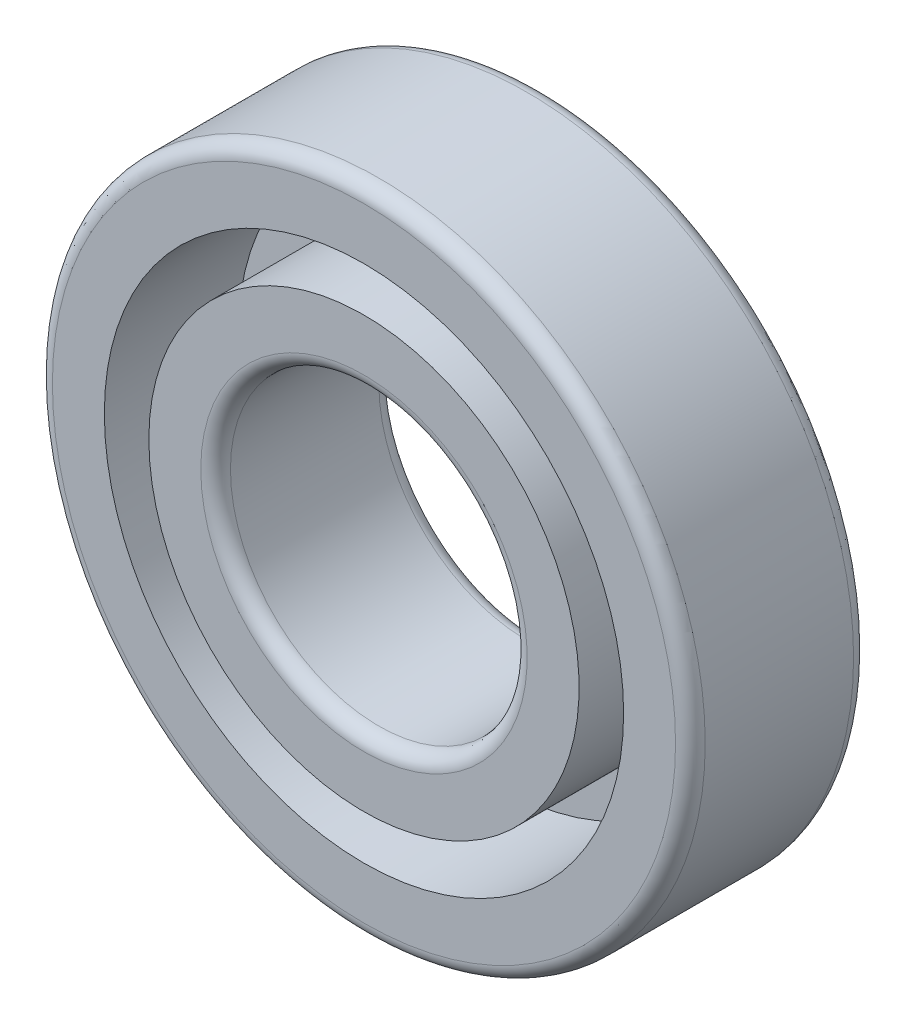
from build123d import *


with BuildPart() as part:
    # Sketch1 → Revolve1 (revolve)
    with BuildSketch(Plane.XZ.offset(-22), mode=Mode.PRIVATE) as revolve1_sk:
        with BuildLine():
            Line((5, 2.5), (5, -2.5))
            ThreePointArc((5, -2.5), (5.146446609, -2.853553391), (5.5, -3))
            Line((5.5, -3), (10.5, -3))
            ThreePointArc((10.5, -3), (10.853553391, -2.853553391), (11, -2.5))
            Line((11, -2.5), (11, 2.5))
            ThreePointArc((11, 2.5), (10.853553391, 2.853553391), (10.5, 3))
            Line((10.5, 3), (8.75, 3))
            Line((8.75, 3), (8.75, -1.5))
            Line((8.75, -1.5), (7.25, -1.5))
            Line((7.25, -1.5), (7.25, 3))
            Line((7.25, 3), (5.5, 3))
            ThreePointArc((5.5, 3), (5.146446609, 2.853553391), (5, 2.5))
        make_face()
    revolve(revolve1_sk.sketch.rotate(Axis((0, 22, 3), (0, 0, -1)), 180), axis=Axis((0, 22, 3), (0, 0, -1)))


solid = part.part
